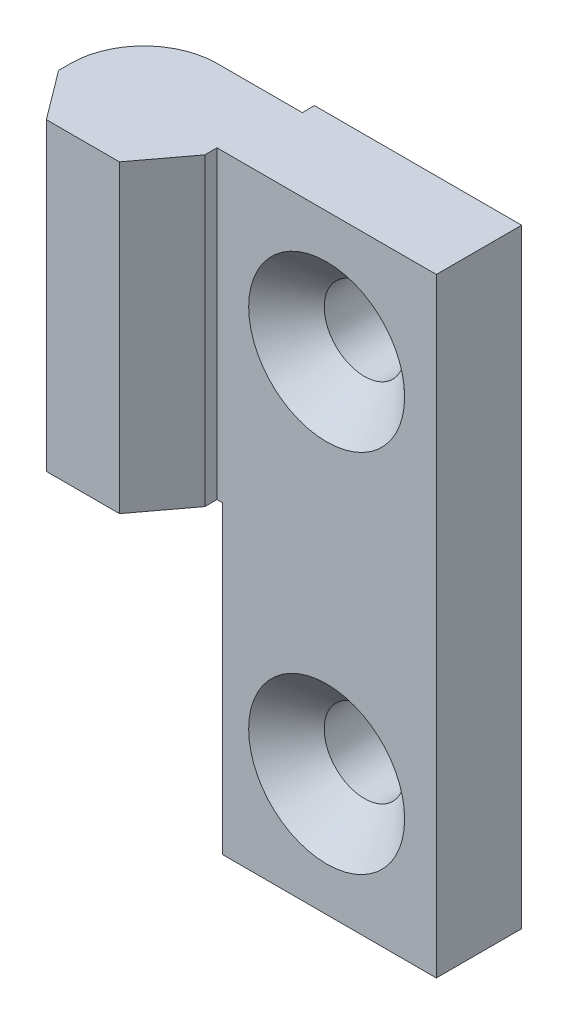
from build123d import *

# Parameters (mm, degrees)
EXTRUDE_1_DEPTH           = 50
FILLET_1_R                = 6
HOLE_WIZARD_1_D           = 6.6
HOLE_WIZARD_1_CSINK_D     = 12.8
HOLE_WIZARD_1_CSINK_ANGLE = 90


with BuildPart() as part:
    # 草图1 → 凸台-拉伸1 (new body)
    with BuildSketch(Plane(origin=(0, 0, 0), x_dir=(1, 0, 0), z_dir=(0, 1, 0))):
        Polygon((0, 0), (-18, 0), (-18, -1), (-21, -5), (-27, -5), (-30, -1), (-30, 6), (-17, 6), (-17, 7), (0, 7), align=None)
    extrude(amount=EXTRUDE_1_DEPTH)

    # 圆角1
    fillet_1_edges = [part.edges().sort_by_distance(p)[0] for p in [
        (-30, 25, -6),
    ]]
    fillet(fillet_1_edges, radius=FILLET_1_R)

    # 打孔尺寸根据内六角花形半沉头螺钉的类型1 (through all)
    with Locations(Plane.XY):
        with Locations((-9, 40), (-9, 10)):
            CounterSinkHole(HOLE_WIZARD_1_D / 2, HOLE_WIZARD_1_CSINK_D / 2, counter_sink_angle=HOLE_WIZARD_1_CSINK_ANGLE)

    # 草图2 → 切除-放样1 section 0
    with BuildSketch(Plane.XY.offset(5)):
        with BuildLine():
            Line((-30, 0), (-18, 0))
            Line((-18, 0), (-18, 25))
            Line((-18, 25), (-30, 25))
            Line((-30, 25), (-30, 0))
        make_face()
    # 草图5 → 切除-放样1 section 1
    with BuildSketch(Plane(origin=(0, 0, -6), x_dir=(-1, 0, 0), z_dir=(0, 0, -1))):
        with BuildLine():
            Line((30, 25), (17, 25))
            Line((17, 25), (17, 0))
            Line((17, 0), (30, 0))
            Line((30, 0), (30, 25))
        make_face()
    loft(mode=Mode.SUBTRACT)


solid = part.part
